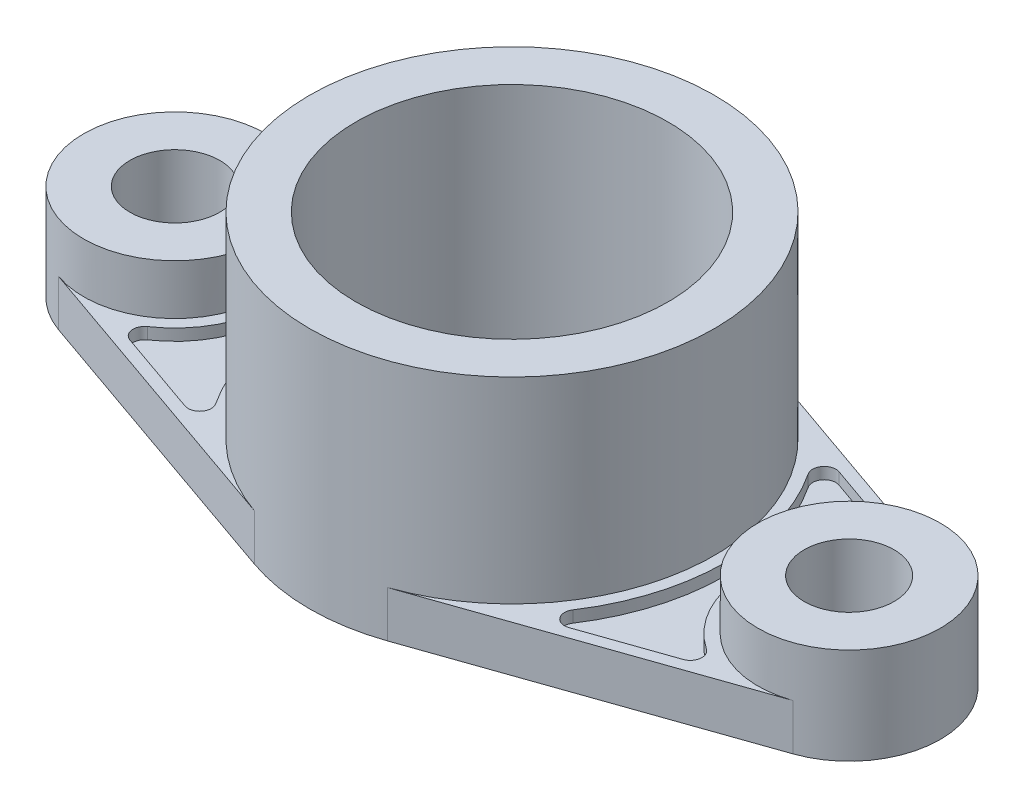
from build123d import *

# Parameters (mm, degrees)
SZKIC1_R                      = 52.5
SZKIC1_R_2                    = 40.5
DODANIE_WYCI_GNI_CIE3_DEPTH   = 63
SZKIC2_R                      = 23.665
SZKIC2_R_2                    = 11.665
DODANIE_WYCI_GNI_CIE4_DEPTH   = 25
DODANIE_WYCI_GNI_CIE4_2_DEPTH = 25
DODANIE_WYCI_GNI_CIE5_DEPTH   = 12
WYTNIJ_WYCI_GNI_CIE1_DEPTH    = 3


with BuildPart() as part:
    # Szkic1 → Dodanie-wyciągnięcie3 (new body)
    with BuildSketch(Plane(origin=(0, 0, 0), x_dir=(1, 0, 0), z_dir=(0, 1, 0))):
        with Locations(Location((0, 0, 0), (0, 0, 270))):
            Circle(SZKIC1_R)
        with Locations(Location((0, 0, 0), (0, 0, 270))):
            Circle(SZKIC1_R_2, mode=Mode.SUBTRACT)
    extrude(amount=DODANIE_WYCI_GNI_CIE3_DEPTH)



with BuildPart() as body_2:
    # Szkic2 → Dodanie-wyciągnięcie4 (new body)
    with BuildSketch(Plane(origin=(0, 0, 0), x_dir=(1, 0, 0), z_dir=(0, 1, 0))):
        with Locations(Location((-87.5, 0, 0), (0, 0, 270))):
            Circle(SZKIC2_R)
        with Locations(Location((-87.5, 0, 0), (0, 0, 270))):
            Circle(SZKIC2_R_2, mode=Mode.SUBTRACT)
    extrude(amount=DODANIE_WYCI_GNI_CIE4_DEPTH)


with BuildPart() as body_3:
    # Szkic2 → Dodanie-wyci_gni_cie4 2 (new body)
    with BuildSketch(Plane(origin=(0, 0, 0), x_dir=(1, 0, 0), z_dir=(0, 1, 0))):
        with Locations(Location((87.5, 0, 0), (0, 0, 270))):
            Circle(SZKIC2_R)
        with Locations(Location((87.5, 0, 0), (0, 0, 270))):
            Circle(SZKIC2_R_2, mode=Mode.SUBTRACT)
    extrude(amount=DODANIE_WYCI_GNI_CIE4_2_DEPTH)


with BuildPart() as part_1:
    add(part.part)

    add(body_2.part)  # Dodanie-wyciągnięcie5 merges body 2

    add(body_3.part)  # Dodanie-wyciągnięcie5 merges body 3
    # Szkic3 → Dodanie-wyciągnięcie5 (add)
    with BuildSketch(Plane(origin=(0, 0, 0), x_dir=(1, 0, 0), z_dir=(0, 1, 0))):
        with BuildLine():
            ThreePointArc((-17.301, -49.56738241), (-52.5, 0), (-17.301, 49.56738241))
            Line((-17.301, 49.56738241), (-95.298631714, 22.343087709))
            ThreePointArc((-95.298631714, 22.343087709), (-73.798218994, 19.29490664), (-63.835, 0))
            ThreePointArc((-63.835, 0), (-73.798218994, -19.29490664), (-95.298631714, -22.343087709))
            Line((-95.298631714, -22.343087709), (-17.301, -49.56738241))
        make_face()
        with BuildLine():
            Line((95.298631714, 22.343087709), (17.301, 49.56738241))
            ThreePointArc((17.301, 49.56738241), (42.805096075, 30.396936523), (52.5, 0))
            ThreePointArc((52.5, 0), (42.805096075, -30.396936523), (17.301, -49.56738241))
            Line((17.301, -49.56738241), (95.298631714, -22.343087709))
            ThreePointArc((95.298631714, -22.343087709), (63.835, 0), (95.298631714, 22.343087709))
        make_face()
    extrude(amount=DODANIE_WYCI_GNI_CIE5_DEPTH)

    # Szkic4 → Wytnij-wyciągnięcie1 (cut)
    with BuildSketch(Plane(origin=(0, 12, 0), x_dir=(1, 0, 0), z_dir=(0, 1, 0))):
        with BuildLine():
            Line((-49.82603874, 35.037349549), (-71.809327621, 27.364302024))
            ThreePointArc((-71.809327621, 27.364302024), (-73.795133067, 24.922702734), (-72.507464694, 22.050988869))
            ThreePointArc((-72.507464694, 22.050988869), (-60.835, 0), (-72.507464694, -22.050988869))
            ThreePointArc((-72.507464694, -22.050988869), (-73.795133067, -24.922702734), (-71.809327621, -27.364302024))
            Line((-71.809327621, -27.364302024), (-49.82603874, -35.037349549))
            ThreePointArc((-49.82603874, -35.037349549), (-46.470783868, -34.048587089), (-46.332927596, -30.553392944))
            ThreePointArc((-46.332927596, -30.553392944), (-55.5, 0), (-46.332927596, 30.553392944))
            ThreePointArc((-46.332927596, 30.553392944), (-46.470783868, 34.048587089), (-49.82603874, 35.037349549))
        make_face()
        with BuildLine():
            Line((71.809327621, -27.364302024), (49.82603874, -35.037349549))
            ThreePointArc((49.82603874, -35.037349549), (46.470783868, -34.048587089), (46.332927596, -30.553392944))
            ThreePointArc((46.332927596, -30.553392944), (55.5, 0), (46.332927596, 30.553392944))
            ThreePointArc((46.332927596, 30.553392944), (46.470783868, 34.048587089), (49.82603874, 35.037349549))
            Line((49.82603874, 35.037349549), (71.809327621, 27.364302024))
            ThreePointArc((71.809327621, 27.364302024), (73.795133067, 24.922702734), (72.507464694, 22.050988869))
            ThreePointArc((72.507464694, 22.050988869), (60.835, 0), (72.507464694, -22.050988869))
            ThreePointArc((72.507464694, -22.050988869), (73.795133067, -24.922702734), (71.809327621, -27.364302024))
        make_face()
    extrude(amount=-WYTNIJ_WYCI_GNI_CIE1_DEPTH, mode=Mode.SUBTRACT)


solid = part_1.part
